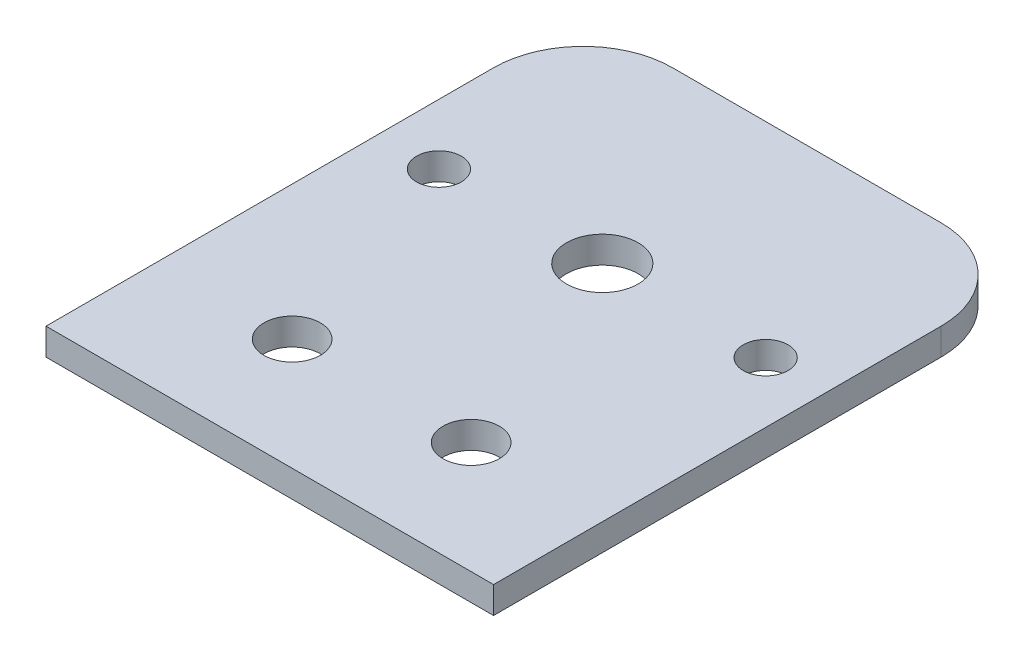
from build123d import *

# Parameters (mm, degrees)
CROQUIS1_R              = 4
CROQUIS1_R_2            = 2.5
CROQUIS1_R_3            = 3.15
SALIENTE_EXTRUIR1_DEPTH = 3


with BuildPart() as part:
    # Croquis1 → Saliente-Extruir1 (new body)
    with BuildSketch(Plane(origin=(0, 0, 0), x_dir=(1, 0, 0), z_dir=(0, 1, 0))):
        with BuildLine():
            Line((25, -37.15), (-25, -37.15))
            Line((-25, -37.15), (-25, 12.85))
            ThreePointArc((-25, 12.85), (-22.071067812, 19.921067812), (-15, 22.85))
            Line((-15, 22.85), (15, 22.85))
            ThreePointArc((15, 22.85), (22.071067812, 19.921067812), (25, 12.85))
            Line((25, 12.85), (25, -37.15))
        make_face()
        with Locations(Location((0, 0, 0), (0, 0, 270))):
            Circle(CROQUIS1_R, mode=Mode.SUBTRACT)
        with Locations(Location((18.25, 0, 0), (0, 0, 270))):
            Circle(CROQUIS1_R_2, mode=Mode.SUBTRACT)
        with Locations(Location((-18.25, 0, 0), (0, 0, 90))):
            Circle(CROQUIS1_R_2, mode=Mode.SUBTRACT)
        with Locations(Location((-10, -24.65, 0), (0, 0, 270))):
            Circle(CROQUIS1_R_3, mode=Mode.SUBTRACT)
        with Locations(Location((10, -24.65, 0), (0, 0, 90))):
            Circle(CROQUIS1_R_3, mode=Mode.SUBTRACT)
    extrude(amount=SALIENTE_EXTRUIR1_DEPTH)


solid = part.part
